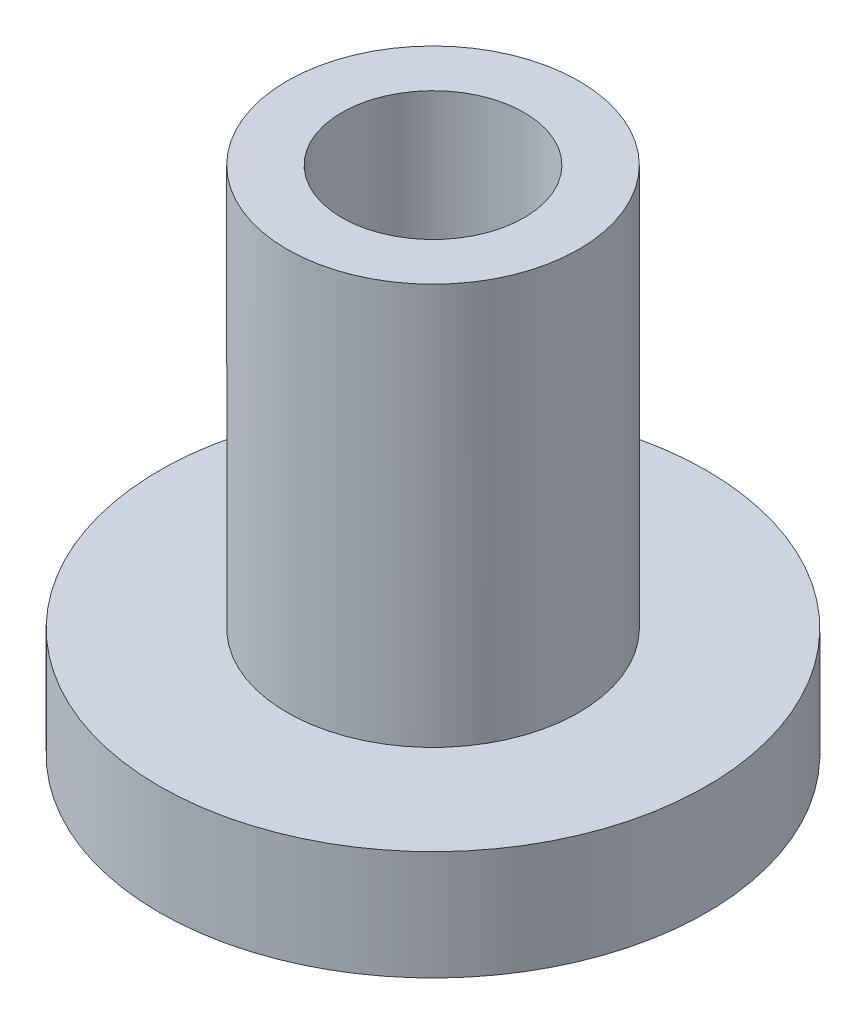
from build123d import *

# Parameters (mm, degrees)
ESBO_O1_R                = 4
RESSALTO_EXTRUS_O1_DEPTH = 11
ESBO_O3_R                = 7.5
RESSALTO_EXTRUS_O3_DEPTH = 3
ESBO_O6_R                = 2.5
CORTE_EXTRUS_O1_DEPTH    = 18.56416807


with BuildPart() as part:
    # Esboço1 → Ressalto-extrusão1 (new body)
    with BuildSketch(Plane(origin=(0, 0, 0), x_dir=(1, 0, 0), z_dir=(0, 1, 0))):
        with Locations(Location((0, 0, 0), (0, 0, 270))):
            Circle(ESBO_O1_R)
    extrude(amount=RESSALTO_EXTRUS_O1_DEPTH)

    # Esboço3 → Ressalto-extrusão3 (add)
    with BuildSketch(Plane.XZ):
        with Locations(Location((0, 0, 0), (0, 0, 270))):
            Circle(ESBO_O3_R)
    extrude(amount=RESSALTO_EXTRUS_O3_DEPTH)

    # Esboço6 → Corte-extrusão1 (cut, through all)
    with BuildSketch(Plane(origin=(0, 11, 0), x_dir=(1, 0, 0), z_dir=(0, 1, 0))):
        with Locations(Location((0, 0, 0), (0, 0, 270))):
            Circle(ESBO_O6_R)
    extrude(amount=-CORTE_EXTRUS_O1_DEPTH, mode=Mode.SUBTRACT)


solid = part.part
